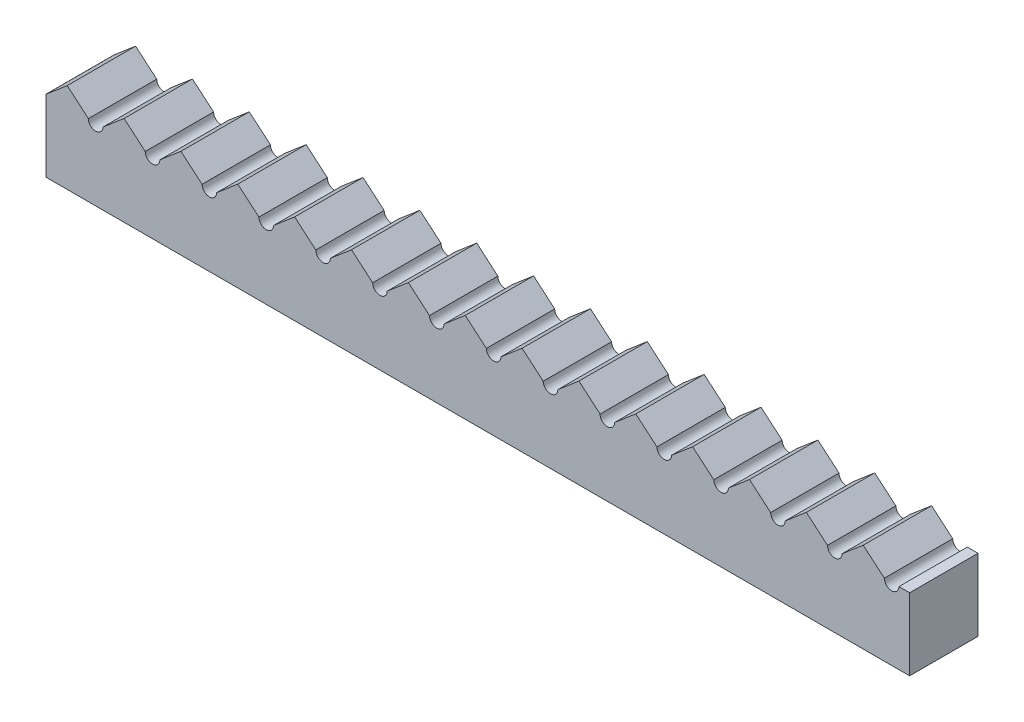
from build123d import *

# Parameters (mm, degrees)
SKETCH1_W           = 304.8
SKETCH1_H           = 25.4
BOSS_EXTRUDE1_DEPTH = 24.13
SKETCH3_R           = 2.57175
CUT_EXTRUDE1_DEPTH  = 39.624
BOSS_EXTRUDE2_DEPTH = 24.13


with BuildPart() as part:
    # Sketch1 → Boss-Extrude1 (new body)
    with BuildSketch(Plane.XY):
        with Locations((-152.4, -12.7)):
            Rectangle(SKETCH1_W, SKETCH1_H)
    extrude(amount=BOSS_EXTRUDE1_DEPTH)

    # Sketch3 → Cut-Extrude1 (cut)
    with BuildSketch(Plane.XY.offset(24.13)):
        with Locations((-26.416, 0)):
            Circle(SKETCH3_R)
        with Locations((-46.482, 0)):
            Circle(SKETCH3_R)
        with Locations((-66.548, 0)):
            Circle(SKETCH3_R)
        with Locations((-86.614, 0)):
            Circle(SKETCH3_R)
        with Locations((-106.68, 0)):
            Circle(SKETCH3_R)
        with Locations((-126.746, 0)):
            Circle(SKETCH3_R)
        with Locations((-146.812, 0)):
            Circle(SKETCH3_R)
        with Locations((-166.878, 0)):
            Circle(SKETCH3_R)
        with Locations((-186.944, 0)):
            Circle(SKETCH3_R)
        with Locations((-6.35, 0)):
            Circle(SKETCH3_R)
        with Locations((-207.01, 0)):
            Circle(SKETCH3_R)
        with Locations((-227.076, 0)):
            Circle(SKETCH3_R)
        with Locations((-247.142, 0)):
            Circle(SKETCH3_R)
        with Locations((-267.208, 0)):
            Circle(SKETCH3_R)
        with Locations((-287.274, 0)):
            Circle(SKETCH3_R)
    extrude(amount=-CUT_EXTRUDE1_DEPTH, mode=Mode.SUBTRACT)

    # Sketch4 → Boss-Extrude2 (add)
    with BuildSketch(Plane(origin=(0, 0, 0), x_dir=(-1, 0, 0), z_dir=(0, 0, -1))):
        Polygon((16.383, 6.35), (8.92175, 0), (23.84425, 0), align=None)
        Polygon((36.449, 6.35), (28.98775, 0), (43.91025, 0), align=None)
        Polygon((63.97625, 0), (56.515, 6.35), (49.05375, 0), align=None)
        Polygon((84.04225, 0), (76.581, 6.35), (69.11975, 0), align=None)
        Polygon((104.10825, 0), (96.647, 6.35), (89.18575, 0), align=None)
        Polygon((124.17425, 0), (116.713, 6.35), (109.25175, 0), align=None)
        Polygon((144.24025, 0), (136.779, 6.35), (129.31775, 0), align=None)
        Polygon((164.30625, 0), (156.845, 6.35), (149.38375, 0), align=None)
        Polygon((184.37225, 0), (176.911, 6.35), (169.44975, 0), align=None)
        Polygon((204.43825, 0), (196.977, 6.35), (189.51575, 0), align=None)
        Polygon((224.50425, 0), (217.043, 6.35), (209.58175, 0), align=None)
        Polygon((244.57025, 0), (237.109, 6.35), (229.64775, 0), align=None)
        Polygon((264.63625, 0), (257.175, 6.35), (249.71375, 0), align=None)
        Polygon((284.70225, 0), (277.241, 6.35), (269.77975, 0), align=None)
        Polygon((304.76825, 0), (297.307, 6.35), (289.84575, 0), align=None)
    extrude(amount=-BOSS_EXTRUDE2_DEPTH)


solid = part.part
